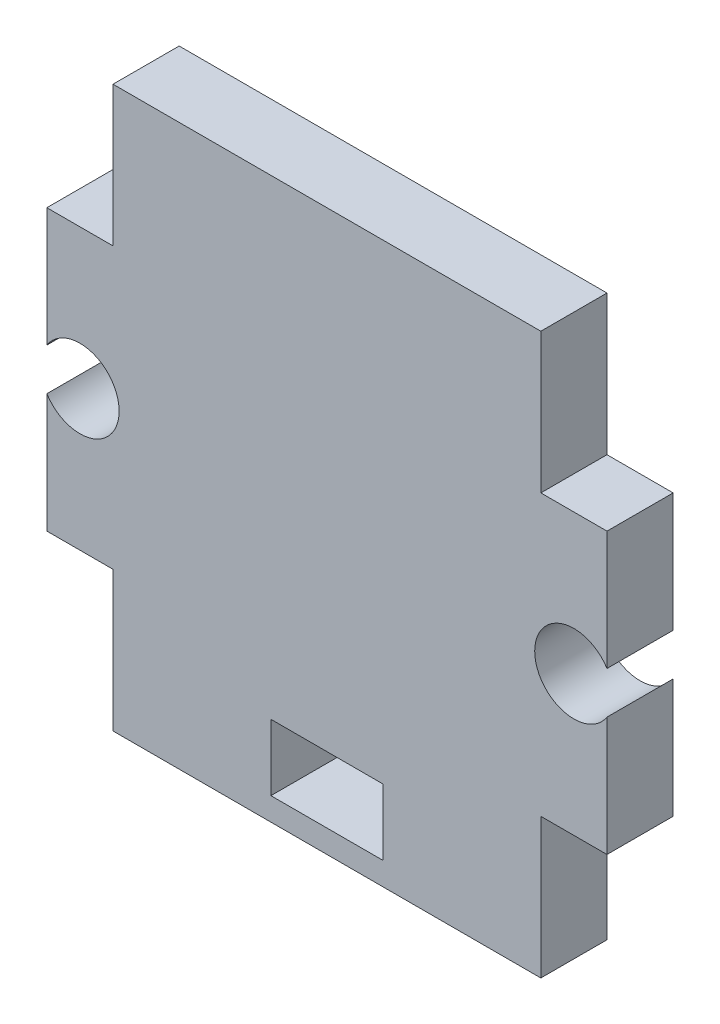
from build123d import *

# Parameters (mm, degrees)
SKETCH1_W           = 25.4
SKETCH1_H           = 25.4
BOSS_EXTRUDE1_DEPTH = 3
SKETCH2_R           = 1.778
SKETCH2_W           = 3
SKETCH2_H           = 6.35
SKETCH2_W_2         = 5.08
SKETCH2_H_2         = 3
CUT_EXTRUDE1_DEPTH  = 19.209338264


with BuildPart() as part:
    # Sketch1 → Boss-Extrude1 (new body)
    with BuildSketch(Plane.XY):
        Rectangle(SKETCH1_W, SKETCH1_H)
    extrude(amount=BOSS_EXTRUDE1_DEPTH)

    # Sketch2 → Cut-Extrude1 (cut, through all)
    with BuildSketch(Plane.XY.offset(3)):
        with Locations((-11.2, 0)):
            Circle(SKETCH2_R)
        with Locations((11.2, 0)):
            Circle(SKETCH2_R)
        with Locations((11.2, 9.525)):
            Rectangle(SKETCH2_W, SKETCH2_H)
        with Locations((11.2, -9.525)):
            Rectangle(SKETCH2_W, SKETCH2_H)
        with Locations((-11.2, 9.525)):
            Rectangle(SKETCH2_W, SKETCH2_H)
        with Locations((-11.2, -9.525)):
            Rectangle(SKETCH2_W, SKETCH2_H)
        with Locations((0, -10.16)):
            Rectangle(SKETCH2_W_2, SKETCH2_H_2)
    extrude(amount=-CUT_EXTRUDE1_DEPTH, mode=Mode.SUBTRACT)


solid = part.part
